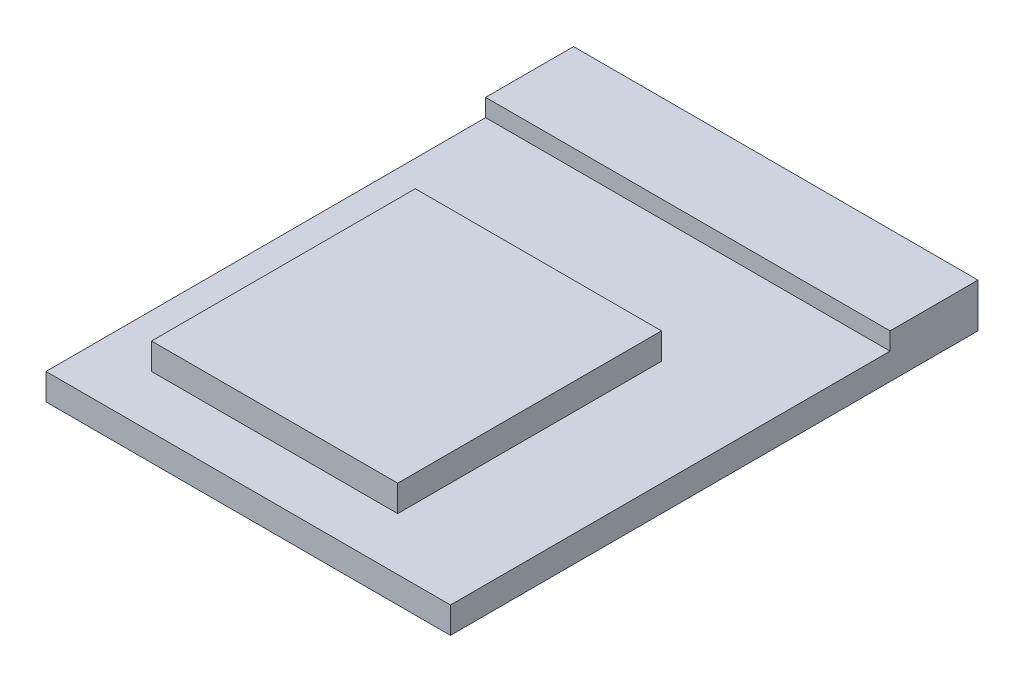
from build123d import *

# Parameters (mm, degrees)
SKETCH_1_W      = 23
SKETCH_1_H      = 30
EXTRUDE_1_DEPTH = 1.5
SKETCH_2_W      = 14
SKETCH_2_H      = 15
EXTRUDE_2_DEPTH = 1.5
SKETCH_3_W      = 23
SKETCH_3_H      = 5
EXTRUDE_3_DEPTH = 1


with BuildPart() as part:
    # Эскиз1 → Бобышка-Вытянуть1 (new body)
    with BuildSketch(Plane(origin=(0, 0, 0), x_dir=(1, 0, 0), z_dir=(0, 1, 0))):
        with Locations((11.5, -15)):
            Rectangle(SKETCH_1_W, SKETCH_1_H)
    extrude(amount=EXTRUDE_1_DEPTH)

    # Эскиз2 → Бобышка-Вытянуть2 (add)
    with BuildSketch(Plane(origin=(0, 1.5, 0), x_dir=(1, 0, 0), z_dir=(0, 1, 0))):
        with Locations((10, -19.5)):
            Rectangle(SKETCH_2_W, SKETCH_2_H)
    extrude(amount=EXTRUDE_2_DEPTH)

    # Эскиз3 → Бобышка-Вытянуть3 (add)
    with BuildSketch(Plane(origin=(0, 1.5, 0), x_dir=(1, 0, 0), z_dir=(0, 1, 0))):
        with Locations((11.5, -2.5)):
            Rectangle(SKETCH_3_W, SKETCH_3_H)
    extrude(amount=EXTRUDE_3_DEPTH)


solid = part.part
